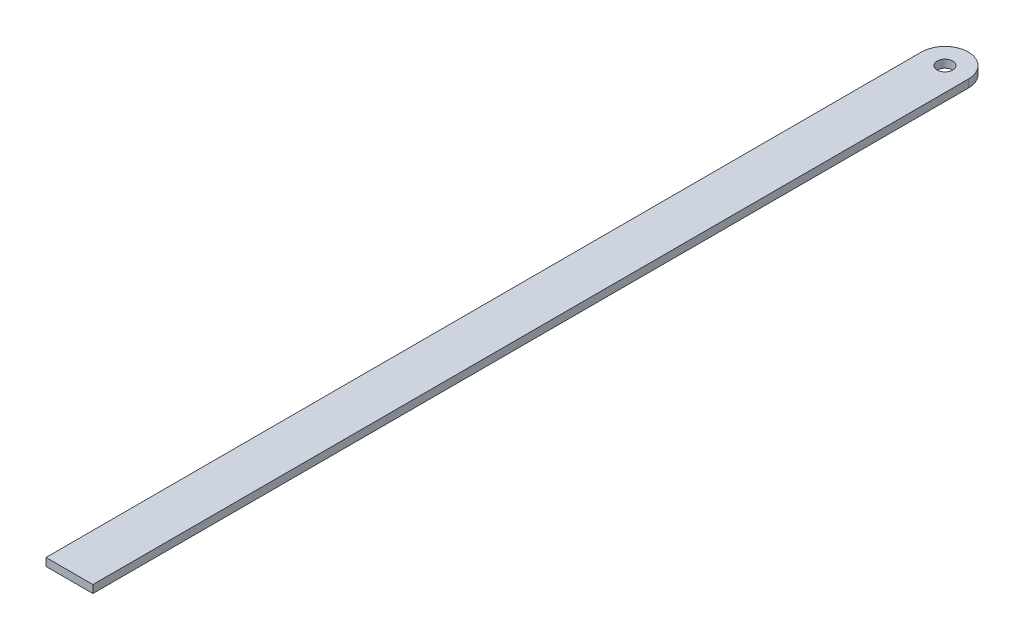
from build123d import *

# Parameters (mm, degrees)
SKETCH1_R           = 1.5875
BOSS_EXTRUDE1_DEPTH = 1.5875


with BuildPart() as part:
    # Sketch1 → Boss-Extrude1 (new body)
    with BuildSketch(Plane(origin=(0, 0, 0), x_dir=(1, 0, 0), z_dir=(0, 1, 0))):
        with BuildLine():
            Line((0, 0), (0, -177.8))
            Line((0, -177.8), (9.525, -177.8))
            Line((9.525, -177.8), (9.525, 0))
            ThreePointArc((9.525, 0), (4.7625, 4.7625), (0, 0))
        make_face()
        with Locations(Location((4.7625, 0, 0), (0, 0, 270))):
            Circle(SKETCH1_R, mode=Mode.SUBTRACT)
    extrude(amount=BOSS_EXTRUDE1_DEPTH)


solid = part.part
